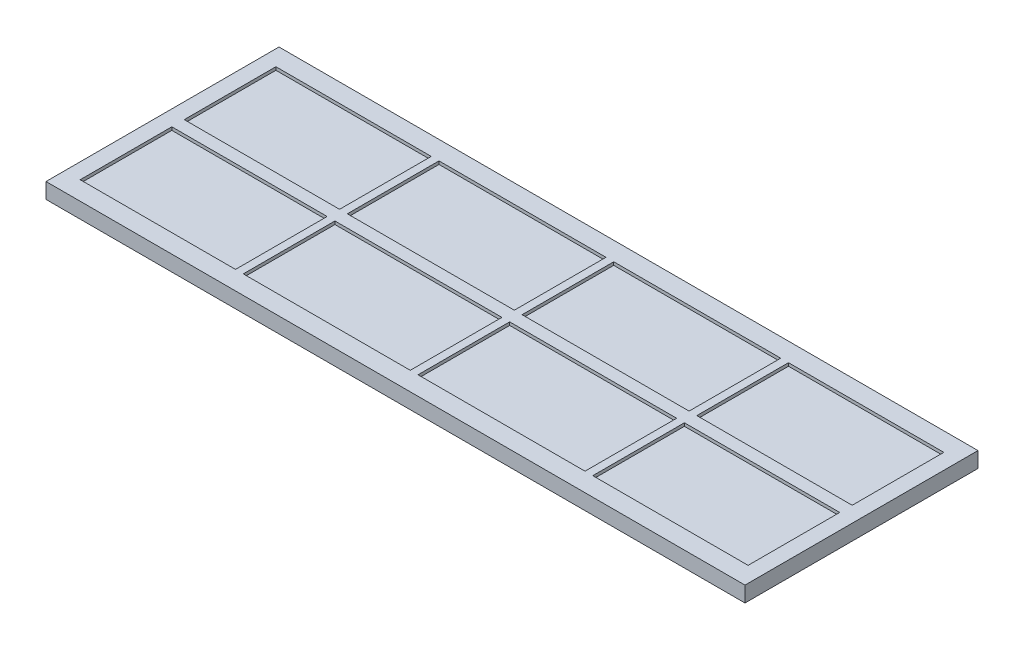
from build123d import *

# Parameters (mm, degrees)
SKETCH1_W             = 100
SKETCH1_H             = 59
BOSS_EXTRUDE1_DEPTH   = 8
SKETCH1_W_2           = 107.5
BOSS_EXTRUDE1_2_DEPTH = 8
BOSS_EXTRUDE1_3_DEPTH = 8
BOSS_EXTRUDE1_4_DEPTH = 8
BOSS_EXTRUDE1_5_DEPTH = 8
BOSS_EXTRUDE1_6_DEPTH = 8
BOSS_EXTRUDE1_7_DEPTH = 8
BOSS_EXTRUDE1_8_DEPTH = 8
SKETCH1_3_W           = 450
SKETCH1_3_H           = 150
SKETCH1_3_W_2         = 100
SKETCH1_3_H_2         = 59
SKETCH1_3_W_3         = 107.5
BOSS_EXTRUDE2_DEPTH   = 10


with BuildPart() as part:
    # Sketch1 → Boss-Extrude1 (new body)
    with BuildSketch(Plane(origin=(0, 0, 0), x_dir=(1, 0, 0), z_dir=(0, 1, 0))):
        with Locations((-165, 33.5)):
            Rectangle(SKETCH1_W, SKETCH1_H)
    extrude(amount=BOSS_EXTRUDE1_DEPTH)



with BuildPart() as body_2:
    # Sketch1 → Boss-Extrude1 2 (new body)
    with BuildSketch(Plane(origin=(0, 0, 0), x_dir=(1, 0, 0), z_dir=(0, 1, 0))):
        with Locations((-56.25, 33.5)):
            Rectangle(SKETCH1_W_2, SKETCH1_H)
    extrude(amount=BOSS_EXTRUDE1_2_DEPTH)


with BuildPart() as body_3:
    # Sketch1 → Boss-Extrude1 3 (new body)
    with BuildSketch(Plane(origin=(0, 0, 0), x_dir=(1, 0, 0), z_dir=(0, 1, 0))):
        with Locations((-165, -33.5)):
            Rectangle(SKETCH1_W, SKETCH1_H)
    extrude(amount=BOSS_EXTRUDE1_3_DEPTH)


with BuildPart() as body_4:
    # Sketch1 → Boss-Extrude1 4 (new body)
    with BuildSketch(Plane(origin=(0, 0, 0), x_dir=(1, 0, 0), z_dir=(0, 1, 0))):
        with Locations((56.25, 33.5)):
            Rectangle(SKETCH1_W_2, SKETCH1_H)
    extrude(amount=BOSS_EXTRUDE1_4_DEPTH)


with BuildPart() as body_5:
    # Sketch1 → Boss-Extrude1 5 (new body)
    with BuildSketch(Plane(origin=(0, 0, 0), x_dir=(1, 0, 0), z_dir=(0, 1, 0))):
        with Locations((-56.25, -33.5)):
            Rectangle(SKETCH1_W_2, SKETCH1_H)
    extrude(amount=BOSS_EXTRUDE1_5_DEPTH)


with BuildPart() as body_6:
    # Sketch1 → Boss-Extrude1 6 (new body)
    with BuildSketch(Plane(origin=(0, 0, 0), x_dir=(1, 0, 0), z_dir=(0, 1, 0))):
        with Locations((165, 33.5)):
            Rectangle(SKETCH1_W, SKETCH1_H)
    extrude(amount=BOSS_EXTRUDE1_6_DEPTH)


with BuildPart() as body_7:
    # Sketch1 → Boss-Extrude1 7 (new body)
    with BuildSketch(Plane(origin=(0, 0, 0), x_dir=(1, 0, 0), z_dir=(0, 1, 0))):
        with Locations((56.25, -33.5)):
            Rectangle(SKETCH1_W_2, SKETCH1_H)
    extrude(amount=BOSS_EXTRUDE1_7_DEPTH)


with BuildPart() as body_8:
    # Sketch1 → Boss-Extrude1 8 (new body)
    with BuildSketch(Plane(origin=(0, 0, 0), x_dir=(1, 0, 0), z_dir=(0, 1, 0))):
        with Locations((165, -33.5)):
            Rectangle(SKETCH1_W, SKETCH1_H)
    extrude(amount=BOSS_EXTRUDE1_8_DEPTH)


with BuildPart() as part_1:
    add(part.part)

    add(body_3.part)  # Boss-Extrude2 merges body 3

    add(body_2.part)  # Boss-Extrude2 merges body 2

    add(body_5.part)  # Boss-Extrude2 merges body 5

    add(body_4.part)  # Boss-Extrude2 merges body 4

    add(body_7.part)  # Boss-Extrude2 merges body 7

    add(body_8.part)  # Boss-Extrude2 merges body 8
    # Sketch1<3> → Boss-Extrude2 (add)
    with BuildSketch(Plane(origin=(0, 0, 0), x_dir=(1, 0, 0), z_dir=(0, 1, 0))):
        Rectangle(SKETCH1_3_W, SKETCH1_3_H)
        with Locations((-165, 33.5)):
            Rectangle(SKETCH1_3_W_2, SKETCH1_3_H_2, mode=Mode.SUBTRACT)
        with Locations((-56.25, 33.5)):
            Rectangle(SKETCH1_3_W_3, SKETCH1_3_H_2, mode=Mode.SUBTRACT)
        with Locations((-165, -33.5)):
            Rectangle(SKETCH1_3_W_2, SKETCH1_3_H_2, mode=Mode.SUBTRACT)
        with Locations((56.25, 33.5)):
            Rectangle(SKETCH1_3_W_3, SKETCH1_3_H_2, mode=Mode.SUBTRACT)
        with Locations((-56.25, -33.5)):
            Rectangle(SKETCH1_3_W_3, SKETCH1_3_H_2, mode=Mode.SUBTRACT)
        with Locations((165, 33.5)):
            Rectangle(SKETCH1_3_W_2, SKETCH1_3_H_2, mode=Mode.SUBTRACT)
        with Locations((56.25, -33.5)):
            Rectangle(SKETCH1_3_W_3, SKETCH1_3_H_2, mode=Mode.SUBTRACT)
        with Locations((165, -33.5)):
            Rectangle(SKETCH1_3_W_2, SKETCH1_3_H_2, mode=Mode.SUBTRACT)
    extrude(amount=BOSS_EXTRUDE2_DEPTH)


solid = Compound([body_6.part, part_1.part])
